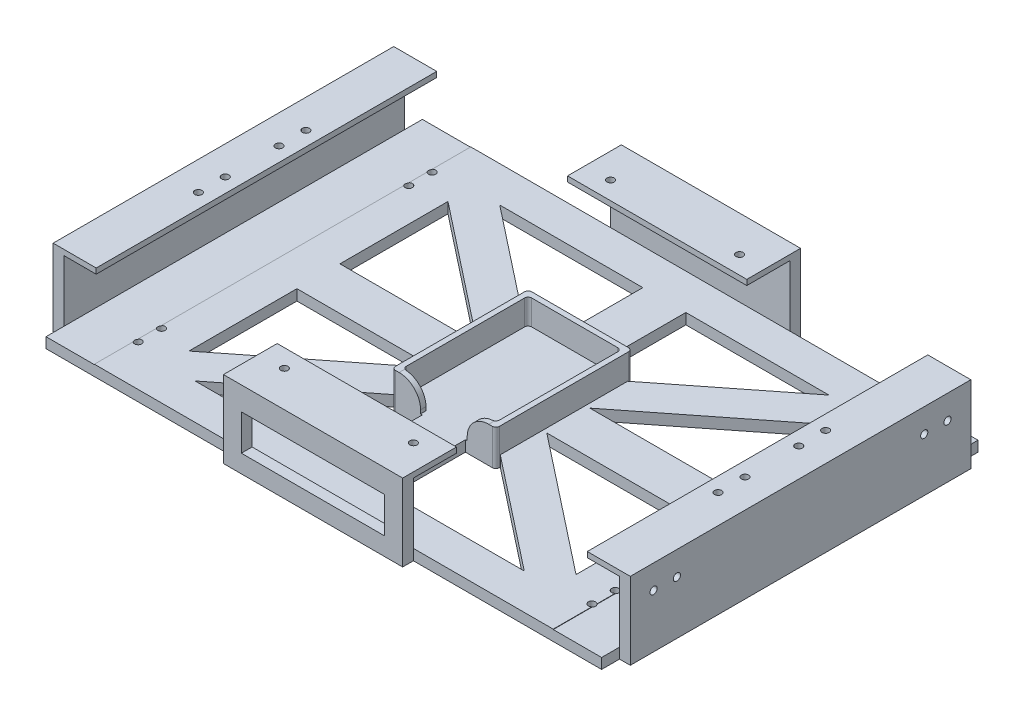
from build123d import *

# Parameters (mm, degrees)
SKETCH1_W                                  = 128
SKETCH1_H                                  = 105
BOSS_EXTRUDE1_DEPTH                        = 3
SKETCH2_W                                  = 13.5
SKETCH2_H                                  = 105
BOSS_EXTRUDE2_DEPTH                        = 2.9
BOSS_EXTRUDE9_DEPTH                        = 7
FILLET1_R                                  = 6
FILLET2_R                                  = 1
CUT_EXTRUDE1_DEPTH                         = 7
SKETCH3_W                                  = 3
SKETCH3_H                                  = 95
BOSS_EXTRUDE10_DEPTH                       = 20
SKETCH11_R                                 = 1
CUT_EXTRUDE2_DEPTH                         = 20
SKETCH13_R                                 = 1
CUT_EXTRUDE3_DEPTH                         = 20
MIRROR1_AT_THE_SECOND_PLANE_COPY_1_SKETC_R = 1
MIRROR1_AT_THE_SECOND_PLANE_COPY_1_DEPTH   = 20
SKETCH4_W                                  = 50
SKETCH4_H                                  = 3
SKETCH4_W_2                                = 25
BOSS_EXTRUDE11_DEPTH                       = 20
CUT_EXTRUDE4_REACH                         = 140.569
SKETCH14_W                                 = 40
SKETCH14_H                                 = 10
SKETCH15_W                                 = 50
SKETCH15_H                                 = 15
BOSS_EXTRUDE12_DEPTH                       = 1.5
SKETCH17_R                                 = 1
CUT_EXTRUDE5_DEPTH                         = 1.5
SKETCH18_W                                 = 12
SKETCH18_H                                 = 95
SKETCH18_R                                 = 1
BOSS_EXTRUDE13_DEPTH                       = 1.5


with BuildPart() as part:
    # Sketch1 → Boss-Extrude1 (new body)
    with BuildSketch(Plane(origin=(0, 0, 0), x_dir=(1, 0, 0), z_dir=(0, 1, 0))):
        Rectangle(SKETCH1_W, SKETCH1_H)
    extrude(amount=BOSS_EXTRUDE1_DEPTH)

    # Sketch2 → Boss-Extrude2 (add)
    with BuildSketch(Plane(origin=(0, 0, 0), x_dir=(1, 0, 0), z_dir=(0, 1, 0))):
        with Locations((-70.75, 0)):
            Rectangle(SKETCH2_W, SKETCH2_H)
        with Locations((70.75, 0)):
            Rectangle(SKETCH2_W, SKETCH2_H)
    extrude(amount=BOSS_EXTRUDE2_DEPTH)

    # Sketch5 → Boss-Extrude9 (add)
    with BuildSketch(Plane(origin=(0, 3, 0), x_dir=(1, 0, 0), z_dir=(0, 1, 0))):
        Polygon((-6.5, -19), (-6.5, -17.5), (-13, -17.5), (-13, 17.5), (13, 17.5), (13, -17.5), (6.5, -17.5), (6.5, -19), (14.5, -19), (14.5, 19), (-14.5, 19), (-14.5, -19), align=None)
    extrude(amount=BOSS_EXTRUDE9_DEPTH)

    # Fillet1
    fillet1_edges = [part.edges().sort_by_distance(p)[0] for p in [
        (-6.5, 10, 18.25),
        (6.5, 10, 18.25),
    ]]
    fillet(fillet1_edges, radius=FILLET1_R)

    # Fillet2
    fillet2_edges = [part.edges().sort_by_distance(p)[0] for p in [
        (-13, 6.5, 17.5),
        (13, 6.5, 17.5),
        (-13, 6.5, -17.5),
        (14.5, 6.5, -19),
        (14.5, 6.5, 19),
        (13, 6.5, -17.5),
        (-14.5, 6.5, -19),
        (-14.5, 6.5, 19),
    ]]
    fillet(fillet2_edges, radius=FILLET2_R)

    # Sketch10 → Cut-Extrude1 (cut)
    with BuildSketch(Plane(origin=(0, 3, 0), x_dir=(1, 0, 0), z_dir=(0, 1, 0))):
        Polygon((-54, 36.137163962), (-54, 6), (-15.708074024, 6), align=None)
        with BuildLine():
            Line((-6, 42.5), (-45.915455387, 42.5))
            Line((-45.915455387, 42.5), (-14.5, 17.774873075))
            Line((-14.5, 17.774873075), (-14.5, 18))
            ThreePointArc((-14.5, 18), (-14.207106781, 18.707106781), (-13.5, 19))
            Line((-13.5, 19), (-6, 19))
            Line((-6, 19), (-6, 42.5))
        make_face()
        with BuildLine():
            Line((45.915455387, 42.5), (6, 42.5))
            Line((6, 42.5), (6, 19))
            Line((6, 19), (13.5, 19))
            ThreePointArc((13.5, 19), (14.207106781, 18.707106781), (14.5, 18))
            Line((14.5, 18), (14.5, 17.774873075))
            Line((14.5, 17.774873075), (45.915455387, 42.5))
        make_face()
        Polygon((15.708074024, 6), (54, 6), (54, 36.137163962), align=None)
        Polygon((15.708074024, -6), (54, -36.137163962), (54, -6), align=None)
        with BuildLine():
            Line((6, -19), (6, -42.5))
            Line((6, -42.5), (45.915455387, -42.5))
            Line((45.915455387, -42.5), (14.5, -17.774873075))
            Line((14.5, -17.774873075), (14.5, -18))
            ThreePointArc((14.5, -18), (14.207106781, -18.707106781), (13.5, -19))
            Line((13.5, -19), (6.5, -19))
            Line((6.5, -19), (6, -19))
        make_face()
        with BuildLine():
            Line((-14.5, -17.774873075), (-45.915455387, -42.5))
            Line((-45.915455387, -42.5), (-6, -42.5))
            Line((-6, -42.5), (-6, -19))
            Line((-6, -19), (-6.5, -19))
            Line((-6.5, -19), (-13.5, -19))
            ThreePointArc((-13.5, -19), (-14.207106781, -18.707106781), (-14.5, -18))
            Line((-14.5, -18), (-14.5, -17.774873075))
        make_face()
        Polygon((-54, -6), (-54, -36.137163962), (-15.708074024, -6), align=None)
    extrude(amount=-CUT_EXTRUDE1_DEPTH, mode=Mode.SUBTRACT)

    # Sketch3 → Boss-Extrude10 (add)
    with BuildSketch(Plane(origin=(0, 0, 0), x_dir=(1, 0, 0), z_dir=(0, 1, 0))):
        with Locations((-79, 0)):
            Rectangle(SKETCH3_W, SKETCH3_H)
        with Locations((79, 0)):
            Rectangle(SKETCH3_W, SKETCH3_H)
    extrude(amount=BOSS_EXTRUDE10_DEPTH)

    # Sketch11 → Cut-Extrude2 (cut)
    with BuildSketch(Plane(origin=(0, 3, 0), x_dir=(1, 0, 0), z_dir=(0, 1, 0))):
        with Locations(Location((-63.3, -41, 0), (0, 0, 270))):
            Circle(SKETCH11_R)
        with Locations(Location((-63.3, -34.5, 0), (0, 0, 270))):
            Circle(SKETCH11_R)
        with Locations(Location((-63.3, 34.5, 0), (0, 0, 270))):
            Circle(SKETCH11_R)
        with Locations(Location((-63.3, 41, 0), (0, 0, 270))):
            Circle(SKETCH11_R)
        with Locations(Location((63.3, 41, 0), (0, 0, 270))):
            Circle(SKETCH11_R)
        with Locations(Location((63.3, 34.5, 0), (0, 0, 270))):
            Circle(SKETCH11_R)
        with Locations(Location((63.3, -34.5, 0), (0, 0, 270))):
            Circle(SKETCH11_R)
        with Locations(Location((63.3, -41, 0), (0, 0, 270))):
            Circle(SKETCH11_R)
    extrude(amount=-CUT_EXTRUDE2_DEPTH, mode=Mode.SUBTRACT)

    # Sketch13 → Cut-Extrude3 (cut)
    with BuildSketch(Plane(origin=(-77.5, 0, 0), x_dir=(0, 0, -1), z_dir=(1, 0, 0))):
        with Locations((-41, 14.842473729)):
            Circle(SKETCH13_R)
        with Locations((-34.5, 14.842473729)):
            Circle(SKETCH13_R)
    cut_extrude3 = extrude(amount=-CUT_EXTRUDE3_DEPTH, mode=Mode.SUBTRACT)

    # Mirror1: Cut-Extrude3 across plane
    add(cut_extrude3.mirror(Plane.XY), mode=Mode.SUBTRACT)

    # Mirror1 at the second plane: Cut-Extrude3 across plane
    add(cut_extrude3.mirror(Plane(origin=(0, 0, 0), x_dir=(0, 0, 1), z_dir=(1, 0, 0))), mode=Mode.SUBTRACT)

    # Mirror1 at the second plane copy 1 sketc → Mirror1 at the second plane copy 1 (cut)
    with BuildSketch(Plane.ZY.offset(-77.5)):
        with Locations((-41, 14.842473729)):
            Circle(MIRROR1_AT_THE_SECOND_PLANE_COPY_1_SKETC_R)
        with Locations((-34.5, 14.842473729)):
            Circle(MIRROR1_AT_THE_SECOND_PLANE_COPY_1_SKETC_R)
    extrude(amount=-MIRROR1_AT_THE_SECOND_PLANE_COPY_1_DEPTH, mode=Mode.SUBTRACT)

    # Sketch4 → Boss-Extrude11 (add)
    with BuildSketch(Plane(origin=(0, 0, 0), x_dir=(1, 0, 0), z_dir=(0, 1, 0))):
        with Locations((0, 54)):
            Rectangle(SKETCH4_W, SKETCH4_H)
        with Locations((-12.5, -54)):
            Rectangle(SKETCH4_W_2, SKETCH4_H)
        with Locations((12.5, -54)):
            Rectangle(SKETCH4_W_2, SKETCH4_H)
    extrude(amount=BOSS_EXTRUDE11_DEPTH)

    # Sketch14 → Cut-Extrude4 (cut, up to next)
    with BuildSketch(Plane.XY.offset(55.5), mode=Mode.PRIVATE) as cut_extrude4_sk1:
        with Locations((0, 10)):
            Rectangle(SKETCH14_W, SKETCH14_H)
    cut_extrude4_tool1 = extrude(cut_extrude4_sk1.sketch, amount=-CUT_EXTRUDE4_REACH, mode=Mode.PRIVATE) & part.part
    add(cut_extrude4_tool1.solids().sort_by_distance((0, 10, 55.5))[0], mode=Mode.SUBTRACT)

    # Sketch15 → Boss-Extrude12 (add)
    with BuildSketch(Plane(origin=(0, 20, 0), x_dir=(1, 0, 0), z_dir=(0, 1, 0))):
        with Locations((0, -48)):
            Rectangle(SKETCH15_W, SKETCH15_H)
    boss_extrude12 = extrude(amount=BOSS_EXTRUDE12_DEPTH)

    # Sketch17 → Cut-Extrude5 (cut)
    with BuildSketch(Plane(origin=(0, 21.5, 0), x_dir=(1, 0, 0), z_dir=(0, 1, 0))):
        with Locations(Location((18, -45.5, 0), (0, 0, 270))):
            Circle(SKETCH17_R)
        with Locations(Location((-18, -45.5, 0), (0, 0, 90))):
            Circle(SKETCH17_R)
    cut_extrude5 = extrude(amount=-CUT_EXTRUDE5_DEPTH, mode=Mode.SUBTRACT)

    # Mirror2: Boss-Extrude12, Cut-Extrude5 across plane
    add(boss_extrude12.mirror(Plane.XY))
    add(cut_extrude5.mirror(Plane.XY), mode=Mode.SUBTRACT)

    # Sketch18 → Boss-Extrude13 (add)
    with BuildSketch(Plane(origin=(0, 20, 0), x_dir=(1, 0, 0), z_dir=(0, 1, 0))):
        with Locations((-74.5, 0)):
            Rectangle(SKETCH18_W, SKETCH18_H)
        with Locations(Location((-72.5, -15, 0), (0, 0, 270))):
            Circle(SKETCH18_R, mode=Mode.SUBTRACT)
        with Locations(Location((-72.5, -7.5, 0), (0, 0, 270))):
            Circle(SKETCH18_R, mode=Mode.SUBTRACT)
        with Locations(Location((-72.5, 7.5, 0), (0, 0, 270))):
            Circle(SKETCH18_R, mode=Mode.SUBTRACT)
        with Locations(Location((-72.5, 15, 0), (0, 0, 270))):
            Circle(SKETCH18_R, mode=Mode.SUBTRACT)
    boss_extrude13 = extrude(amount=BOSS_EXTRUDE13_DEPTH)

    # Mirror3: Boss-Extrude13 across plane
    add(boss_extrude13.mirror(Plane(origin=(0, 0, 0), x_dir=(0, 0, 1), z_dir=(1, 0, 0))))


solid = part.part
